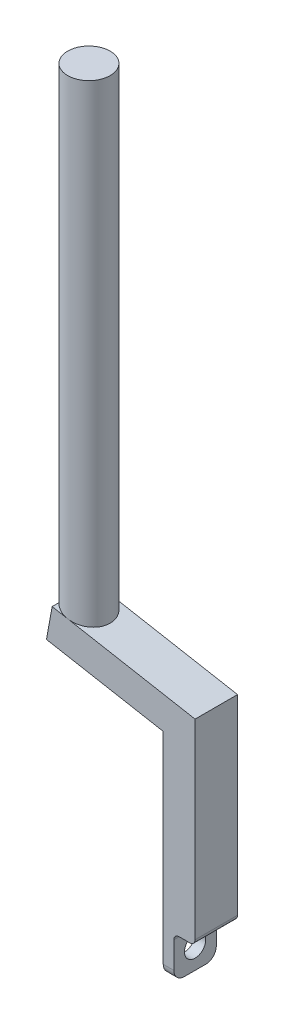
from build123d import *

# Parameters (mm, degrees)
SZKIC1_R                         = 20
DODANIE_WYCI_GNI_CIE1_DEPTH      = 470
DODANIE_WYCI_GNI_CIE2_DEPTH      = 20
DODANIE_WYCI_GNI_CIE2_DEPTH_BACK = 20
WYTNIJ_WYCI_GNI_CIE1_REACH       = 485.115
SZKIC3_R                         = 10
SZKIC4_W                         = 40
SZKIC4_H                         = 40
WYTNIJ_WYCI_GNI_CIE2_DEPTH       = 20
ZAOKR_GLENIE1_R                  = 5
ZAOKR_GLENIE2_R                  = 10


with BuildPart() as part:
    # Szkic1 → Dodanie-wyciągnięcie1 (new body)
    with BuildSketch(Plane(origin=(0, 0, 0), x_dir=(1, 0, 0), z_dir=(0, 1, 0))):
        with Locations(Location((0, 0, 0), (0, 0, 90))):
            Circle(SZKIC1_R)
    extrude(amount=DODANIE_WYCI_GNI_CIE1_DEPTH)

    # Szkic2 → Dodanie-wyciągnięcie2 (add, two sides: drawn at the far end of the back side and taken through both)
    with BuildSketch(Plane.XY.offset(-DODANIE_WYCI_GNI_CIE2_DEPTH_BACK)):
        Polygon((-20, 0), (90, -20), (90, -220), (120, -220), (120, 5.037290602), (-14.633436854, 29.516097303), align=None)
    extrude(amount=DODANIE_WYCI_GNI_CIE2_DEPTH + DODANIE_WYCI_GNI_CIE2_DEPTH_BACK)

    # Szkic3 → Wytnij-wyciągnięcie1 (cut, up to next)
    with BuildSketch(Plane.ZY.offset(-90), mode=Mode.PRIVATE) as wytnij_wyci_gni_cie1_sk1:
        with Locations(Location((0, -200, 0), (0, 0, 270))):
            Circle(SZKIC3_R)
    wytnij_wyci_gni_cie1_tool1 = extrude(wytnij_wyci_gni_cie1_sk1.sketch, amount=-WYTNIJ_WYCI_GNI_CIE1_REACH, mode=Mode.PRIVATE) & part.part
    add(wytnij_wyci_gni_cie1_tool1.solids().sort_by_distance((90, -200, 0))[0], mode=Mode.SUBTRACT)

    # Szkic4 → Wytnij-wyciągnięcie2 (cut)
    with BuildSketch(Plane(origin=(120, 0, 0), x_dir=(0, 0, -1), z_dir=(1, 0, 0))):
        with Locations((0, -200)):
            Rectangle(SZKIC4_W, SZKIC4_H)
    extrude(amount=-WYTNIJ_WYCI_GNI_CIE2_DEPTH, mode=Mode.SUBTRACT)

    # Zaokrąglenie1
    zaokr_glenie1_edges = [part.edges().sort_by_distance(p)[0] for p in [
        (120, -180, 0),
        (100, -180, 0),
    ]]
    fillet(zaokr_glenie1_edges, radius=ZAOKR_GLENIE1_R)

    # Zaokrąglenie2
    zaokr_glenie2_edges = [part.edges().sort_by_distance(p)[0] for p in [
        (95, -220, -20),
        (95, -220, 20),
    ]]
    fillet(zaokr_glenie2_edges, radius=ZAOKR_GLENIE2_R)


solid = part.part
